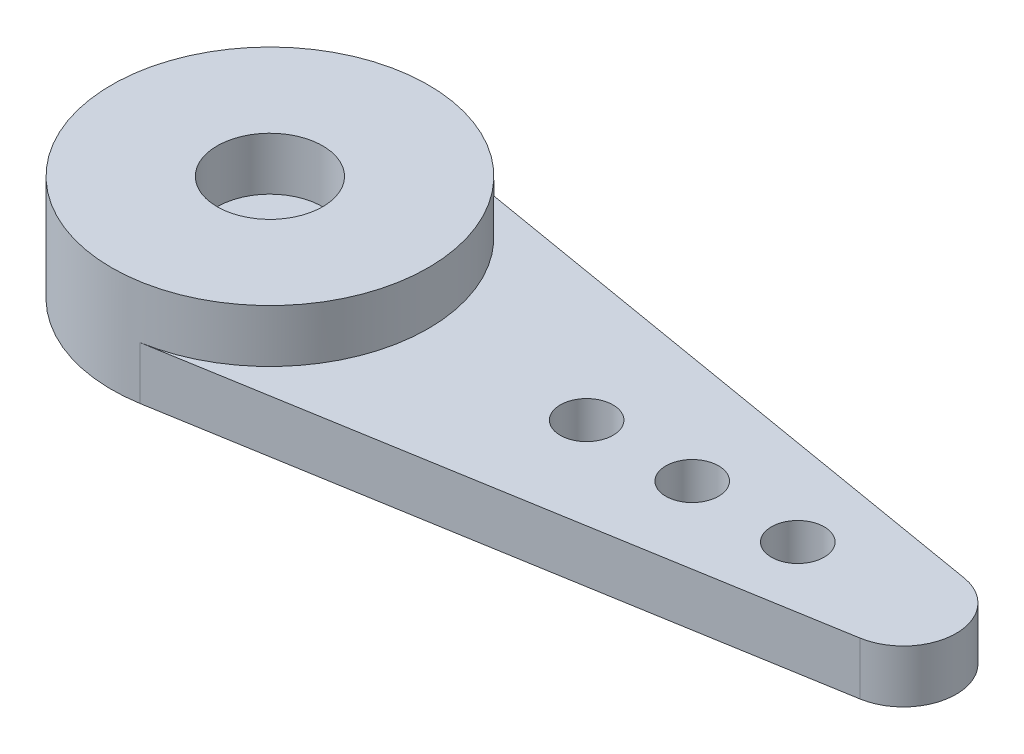
from build123d import *
from build123d.topology import SkipClean

# Parameters (mm, degrees)
BOSS_EXTRUDE1_DEPTH = 5
SKETCH2_R           = 15
BOSS_EXTRUDE2_DEPTH = 5
SKETCH3_R           = 5
CUT_EXTRUDE1_DEPTH  = 5
SKETCH4_R           = 2.5
CUT_EXTRUDE2_DEPTH  = 5
SCALE1_SCALE        = 0.6


with BuildPart() as part:
    # Sketch1 → Boss-Extrude1 (new body)
    with BuildSketch(Plane(origin=(0, 0, 0), x_dir=(1, 0, 0), z_dir=(0, 1, 0))):
        with BuildLine():
            Line((2.5, 14.790199458), (60.833333333, 4.930066486))
            ThreePointArc((60.833333333, 4.930066486), (65, 0), (60.833333333, -4.930066486))
            Line((60.833333333, -4.930066486), (2.5, -14.790199458))
            ThreePointArc((2.5, -14.790199458), (-15, 0), (2.5, 14.790199458))
        make_face()
    extrude(amount=BOSS_EXTRUDE1_DEPTH)

    # Sketch2 → Boss-Extrude2 (add)
    with SkipClean():  # the faces are left unmerged after this step: merging them gives an invalid solid
        with BuildSketch(Plane(origin=(0, 5, 0), x_dir=(1, 0, 0), z_dir=(0, 1, 0))):
            with Locations(Location((0, 0, 0), (0, 0, 80.405931773))):
                Circle(SKETCH2_R)
        extrude(amount=BOSS_EXTRUDE2_DEPTH)

    # Sketch3 → Cut-Extrude1 (cut)
    with SkipClean():  # the faces are left unmerged after this step: merging them gives an invalid solid
        with BuildSketch(Plane(origin=(0, 10, 0), x_dir=(1, 0, 0), z_dir=(0, 1, 0))):
            with Locations(Location((0, 0, 0), (0, 0, 270))):
                Circle(SKETCH3_R)
        extrude(amount=-CUT_EXTRUDE1_DEPTH, mode=Mode.SUBTRACT)

    # Sketch4 → Cut-Extrude2 (cut)
    with SkipClean():  # the faces are left unmerged after this step: merging them gives an invalid solid
        with BuildSketch(Plane(origin=(0, 5, 0), x_dir=(1, 0, 0), z_dir=(0, 1, 0))):
            with Locations(Location((50, 0, 0), (0, 0, 270))):
                Circle(SKETCH4_R)
            with Locations(Location((40, 0, 0), (0, 0, 270))):
                Circle(SKETCH4_R)
            with Locations(Location((30, 0, 0), (0, 0, 270))):
                Circle(SKETCH4_R)
        extrude(amount=-CUT_EXTRUDE2_DEPTH, mode=Mode.SUBTRACT)


with BuildPart() as part_1:
    # Scale1: scaled about (12.970813322, 3.941879124, 0)
    add(part.part.scale(SCALE1_SCALE).moved(Location((5.188325329, 1.57675165, 0))))


solid = part_1.part
